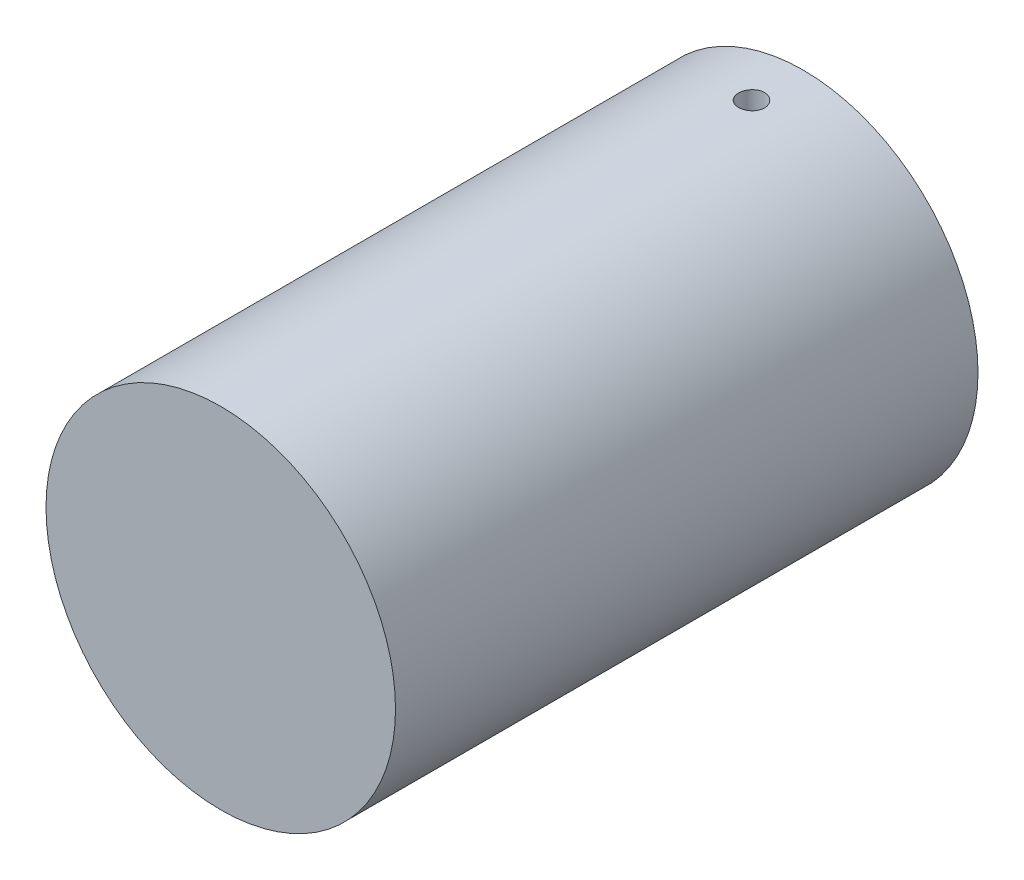
from build123d import *

# Parameters (mm, degrees)
SKETCH1_R               = 13.5
BOSS_EXTRUDE1_DEPTH     = 45
CUT_EXTRUDE1_DEPTH      = 49.88251221
CUT_EXTRUDE1_DEPTH_BACK = 49.88251221
SKETCH2_R               = 1


with BuildPart() as part:
    # Sketch1 → Boss-Extrude1 (new body)
    with BuildSketch(Plane.XY):
        with Locations(Location((0, 0, 0), (0, 0, 180))):
            Circle(SKETCH1_R)
    extrude(amount=BOSS_EXTRUDE1_DEPTH)

    # Sketch2 → Cut-Extrude1 (cut, two sides: drawn at the far end of the back side and taken through both)
    with BuildSketch(Plane(origin=(0, 0, 0), x_dir=(1, 0, 0), z_dir=(0, 1, 0)).offset(-CUT_EXTRUDE1_DEPTH_BACK)):
        with Locations(Location((0, -4, 0), (0, 0, 270))):
            Circle(SKETCH2_R)
    extrude(amount=CUT_EXTRUDE1_DEPTH + CUT_EXTRUDE1_DEPTH_BACK, mode=Mode.SUBTRACT)


solid = part.part
